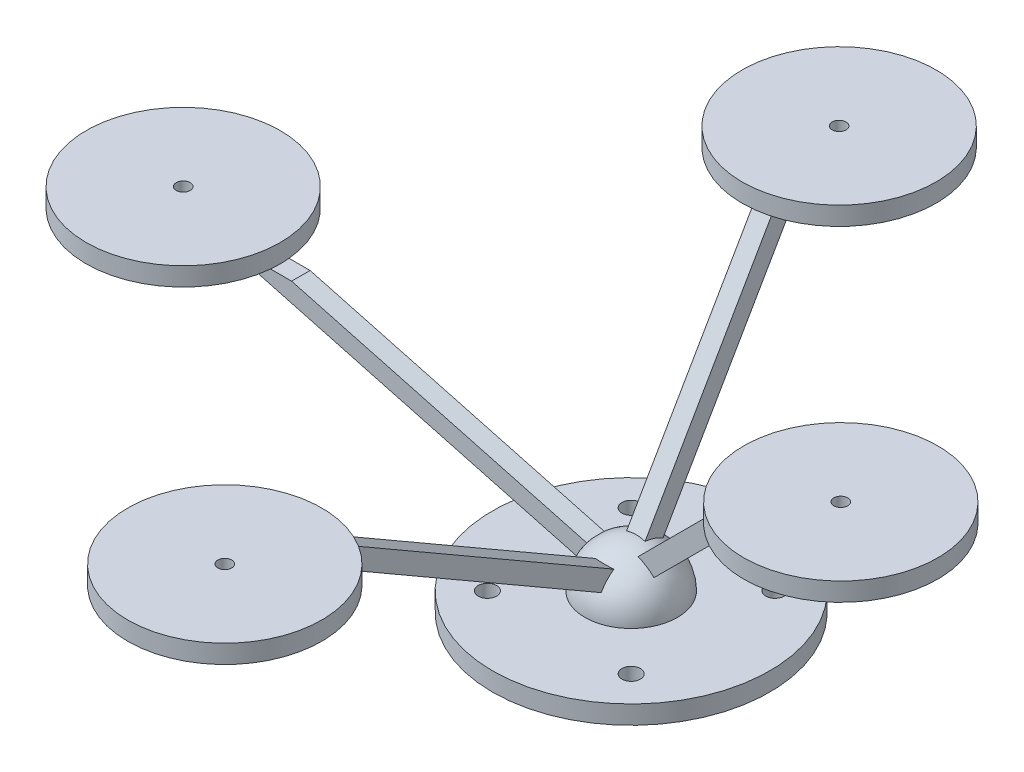
from build123d import *

# Parameters (mm, degrees)
SKETCH_1_R      = 15
SKETCH_1_R_2    = 1
EXTRUDE_1_DEPTH = 2
EXTRUDE_2_DEPTH = 1
SKETCH_4_R      = 10.5
SKETCH_4_R_2    = 0.75
EXTRUDE_3_DEPTH = 2
SKETCH_5_R      = 10.5
SKETCH_5_R_2    = 0.75
EXTRUDE_4_DEPTH = 2
EXTRUDE_5_DEPTH = 1
SKETCH_7_R      = 10.5
SKETCH_7_R_2    = 0.75
EXTRUDE_6_DEPTH = 2
SKETCH_8_R      = 10.5
SKETCH_8_R_2    = 0.75
EXTRUDE_7_DEPTH = 2


with BuildPart() as part:
    # 草图1 → 凸台-拉伸1 (new body)
    with BuildSketch(Plane(origin=(0, 0, 0), x_dir=(1, 0, 0), z_dir=(0, 1, 0))):
        with Locations(Location((0, 0, 0), (0, 0, 270))):
            Circle(SKETCH_1_R)
        with Locations(Location((7.778174593, 7.778174593, 0), (0, 0, 270))):
            Circle(SKETCH_1_R_2, mode=Mode.SUBTRACT)
        with Locations(Location((-7.778174593, 7.778174593, 0), (0, 0, 270))):
            Circle(SKETCH_1_R_2, mode=Mode.SUBTRACT)
        with Locations(Location((-7.778174593, -7.778174593, 0), (0, 0, 270))):
            Circle(SKETCH_1_R_2, mode=Mode.SUBTRACT)
        with Locations(Location((7.778174593, -7.778174593, 0), (0, 0, 270))):
            Circle(SKETCH_1_R_2, mode=Mode.SUBTRACT)
    extrude(amount=EXTRUDE_1_DEPTH)

    # 草图2 → 旋转1 (revolve)
    with BuildSketch(Plane(origin=(0, 0, 0), x_dir=(0, 0, -1), z_dir=(1, 0, 0))):
        with BuildLine():
            Line((0, 2), (0, 7))
            ThreePointArc((0, 7), (3.535533906, 5.535533906), (5, 2))
            Line((5, 2), (0, 2))
        make_face()
    revolve(axis=Axis((0, 2, 0), (0, 1, 0)))

    # 草图3 → 凸台-拉伸2 (add, symmetric)
    with BuildSketch(Plane.XY):
        Polygon((0, 2), (17.67766953, 19.67766953), (14.849242405, 19.67766953), (0, 4.828427125), (0, 4.070552361), (-35.739255573, 13.64685703), (-43.466662183, 13.64685703), align=None)
    extrude(amount=EXTRUDE_2_DEPTH, both=True)

    # 草图4 → 凸台-拉伸3 (add)
    with BuildSketch(Plane(origin=(0, 19.67766953, 0), x_dir=(1, 0, 0), z_dir=(0, 1, 0))):
        with Locations(Location((22.67766953, 0, 0), (0, 0, 270))):
            Circle(SKETCH_4_R)
        with Locations(Location((22.67766953, 0, 0), (0, 0, 270))):
            Circle(SKETCH_4_R_2, mode=Mode.SUBTRACT)
    extrude(amount=EXTRUDE_3_DEPTH)

    # 草图5 → 凸台-拉伸4 (add)
    with BuildSketch(Plane(origin=(0, 13.64685703, 0), x_dir=(1, 0, 0), z_dir=(0, 1, 0))):
        with Locations(Location((-48.466662183, 0, 0), (0, 0, 5.4650238))):
            Circle(SKETCH_5_R)
        with Locations(Location((-48.466662183, 0, 0), (0, 0, 270))):
            Circle(SKETCH_5_R_2, mode=Mode.SUBTRACT)
    extrude(amount=EXTRUDE_4_DEPTH)

    # 草图6 → 凸台-拉伸5 (add, symmetric)
    with BuildSketch(Plane(origin=(0, 0, 0), x_dir=(0, 0, -1), z_dir=(1, 0, 0))):
        Polygon((0, 2), (17.5, 32.310889132), (15.190598923, 32.310889132), (0, 6), (0, 4.309401077), (-34.97114317, 24.5), (-38.97114317, 24.5), align=None)
    extrude(amount=EXTRUDE_5_DEPTH, both=True)

    # 草图7 → 凸台-拉伸6 (add)
    with BuildSketch(Plane(origin=(0, 32.310889132, 0), x_dir=(1, 0, 0), z_dir=(0, 1, 0))):
        with Locations(Location((0, 22.5, 0), (0, 0, 270))):
            Circle(SKETCH_7_R)
        with Locations(Location((0, 22.5, 0), (0, 0, 270))):
            Circle(SKETCH_7_R_2, mode=Mode.SUBTRACT)
    extrude(amount=EXTRUDE_6_DEPTH)

    # 草图8 → 凸台-拉伸7 (add)
    with BuildSketch(Plane(origin=(0, 24.5, 0), x_dir=(1, 0, 0), z_dir=(0, 1, 0))):
        with Locations(Location((0, -43.97114317, 0), (0, 0, 270))):
            Circle(SKETCH_8_R)
        with Locations(Location((0, -43.97114317, 0), (0, 0, 270))):
            Circle(SKETCH_8_R_2, mode=Mode.SUBTRACT)
    extrude(amount=EXTRUDE_7_DEPTH)


solid = part.part
